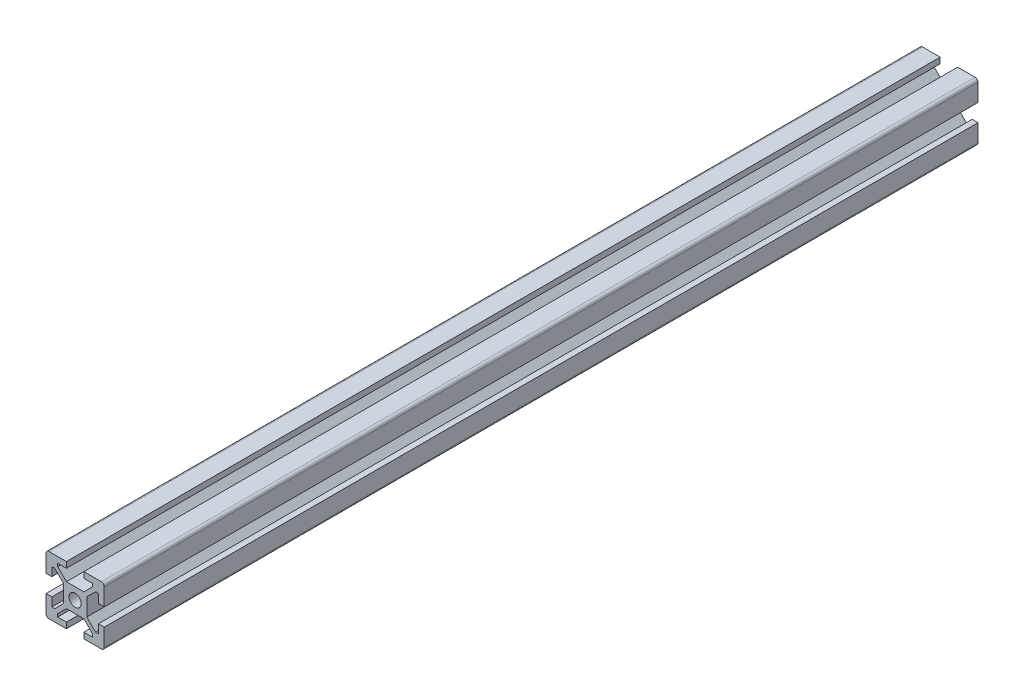
from build123d import *

# Parameters (mm, degrees)
SCHIZZO1_R                   = 2.1
ESTRUSIONE_ESTRUSIONE1_DEPTH = 300
RACCORDO1_R                  = 1


with BuildPart() as part:
    # Schizzo1 → Estrusione-Estrusione1 (new body)
    with BuildSketch(Plane.XY):
        Polygon((10, 3), (10, 10), (3, 10), (3, 8), (6, 8), (6, 7), (3, 4), (-3, 4), (-6, 7), (-6, 8), (-3, 8), (-3, 10), (-10, 10), (-10, 3), (-8, 3), (-8, 6), (-7, 6), (-4, 3), (-4, -3), (-7, -6), (-8, -6), (-8, -3), (-10, -3), (-10, -10), (-3, -10), (-3, -8), (-6, -8), (-6, -7), (-3, -4), (3, -4), (6, -7), (6, -8), (3, -8), (3, -10), (10, -10), (10, -3), (8, -3), (8, -6), (7, -6), (4, -3), (4, 3), (7, 6), (8, 6), (8, 3), align=None)
        Circle(SCHIZZO1_R, mode=Mode.SUBTRACT)
    extrude(amount=ESTRUSIONE_ESTRUSIONE1_DEPTH)

    # Raccordo1
    raccordo1_edges = [part.edges().sort_by_distance(p)[0] for p in [
        (-10, 10, 150),
        (10, 10, 150),
        (10, -10, 150),
        (-10, -10, 150),
    ]]
    fillet(raccordo1_edges, radius=RACCORDO1_R)


solid = part.part
